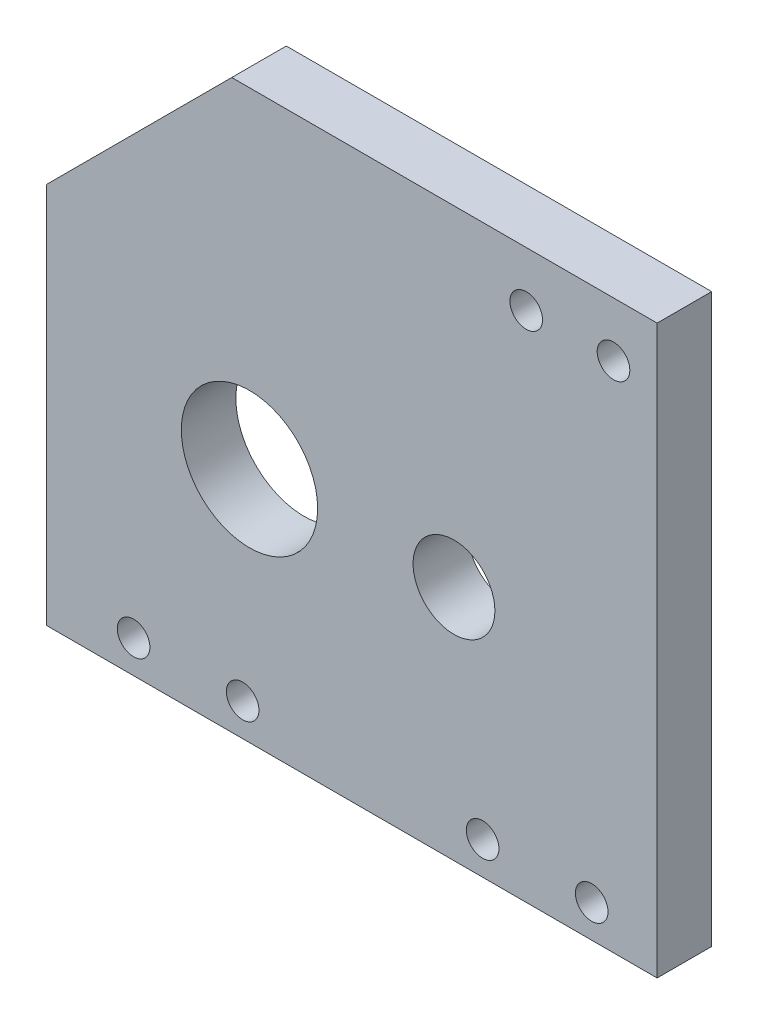
from build123d import *

# Parameters (mm, degrees)
SKETCH1_W             = 71.12
SKETCH1_H             = 66.04
SKETCH1_R             = 7.9375
SKETCH1_R_2           = 4.7625
BOSS_EXTRUDE1_DEPTH   = 6.35
F_6_CLEARANCE_HOLE1_D = 3.7973
CUT_EXTRUDE1_DEPTH    = 49.940336125
F_6_CLEARANCE_HOLE2_D = 3.7973


with BuildPart() as part:
    # Sketch1 → Boss-Extrude1 (new body)
    with BuildSketch(Plane.XY):
        Rectangle(SKETCH1_W, SKETCH1_H)
        with Locations((-11.90625, -5.43814)):
            Circle(SKETCH1_R, mode=Mode.SUBTRACT)
        with Locations((11.90625, -5.43814)):
            Circle(SKETCH1_R_2, mode=Mode.SUBTRACT)
    extrude(amount=BOSS_EXTRUDE1_DEPTH)

    # #6 Clearance Hole1 (through all)
    with Locations(Plane.XY.offset(6.35)):
        with Locations((-25.4, -29.21), (-12.7, -29.21), (15.24, -29.21), (27.94, -29.21)):
            Hole(F_6_CLEARANCE_HOLE1_D / 2)

    # Sketch4 → Cut-Extrude1 (cut, through all)
    with BuildSketch(Plane.XY.offset(6.35)):
        Polygon((-35.56, 11.43), (-35.56, 33.02), (-13.97, 33.02), align=None)
    extrude(amount=-CUT_EXTRUDE1_DEPTH, mode=Mode.SUBTRACT)

    # #6 Clearance Hole2 (through all)
    with Locations(Plane.XY.offset(6.35)):
        with Locations((20.32, 26.67), (30.48, 26.67)):
            Hole(F_6_CLEARANCE_HOLE2_D / 2)


solid = part.part
